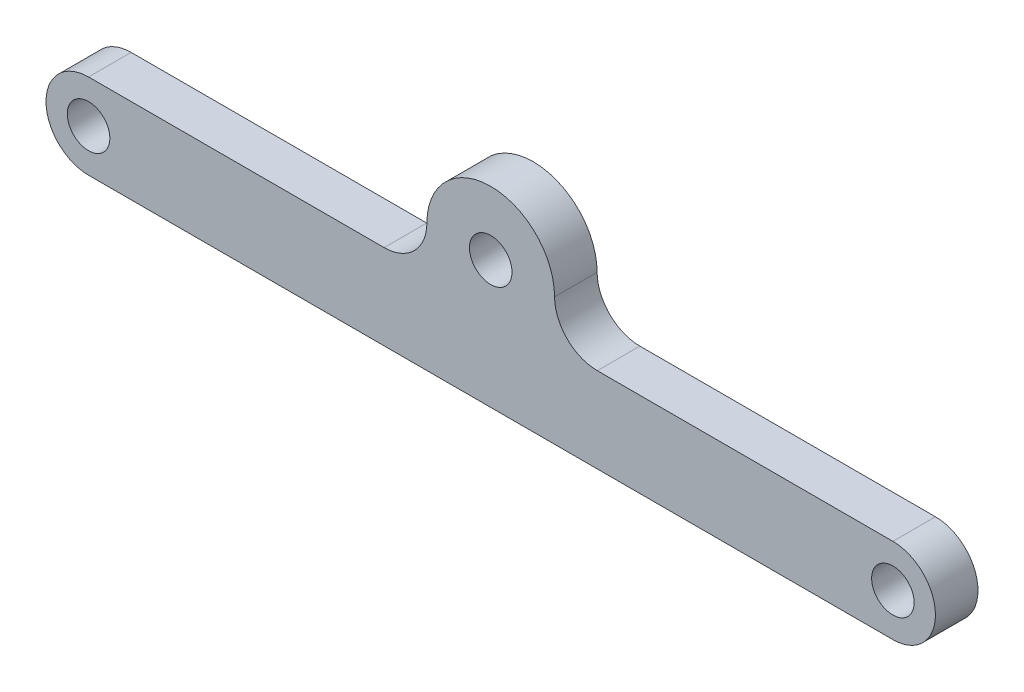
from build123d import *

# Parameters (mm, degrees)
SKETCH1_R           = 6.35
BOSS_EXTRUDE1_DEPTH = 12.7


with BuildPart() as part:
    # Sketch1 → Boss-Extrude1 (new body)
    with BuildSketch(Plane.XY):
        with BuildLine():
            Line((-120.015, 12.7), (-31.809733165, 12.7))
            ThreePointArc((-31.809733165, 12.7), (-22.808332465, 16.416135762), (-19.05, 25.4))
            ThreePointArc((-19.05, 25.4), (0, 44.45), (19.05, 25.4))
            ThreePointArc((19.05, 25.4), (22.808332465, 16.416135762), (31.809733165, 12.7))
            Line((31.809733165, 12.7), (120.015, 12.7))
            ThreePointArc((120.015, 12.7), (132.715, 0), (120.015, -12.7))
            Line((120.015, -12.7), (-120.015, -12.7))
            ThreePointArc((-120.015, -12.7), (-132.715, 0), (-120.015, 12.7))
        make_face()
        with Locations((-120.015, 0)):
            Circle(SKETCH1_R, mode=Mode.SUBTRACT)
        with Locations((120.015, 0)):
            Circle(SKETCH1_R, mode=Mode.SUBTRACT)
        with Locations((0, 25.4)):
            Circle(SKETCH1_R, mode=Mode.SUBTRACT)
    extrude(amount=BOSS_EXTRUDE1_DEPTH)


solid = part.part
